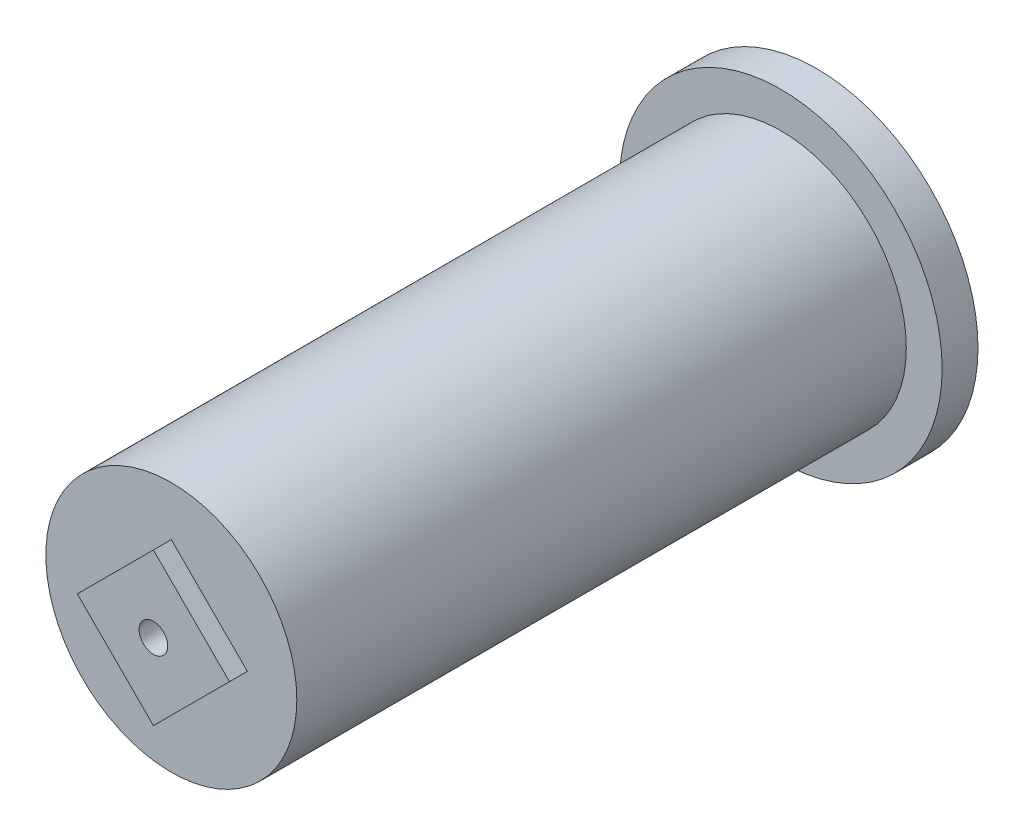
from build123d import *

# Parameters (mm, degrees)
SKETCH_1_R          = 22.5
EXTRUDE_1_DEPTH     = 5
SKETCH_2_R          = 17.5
EXTRUDE_2_DEPTH     = 85
EXTRUDE_3_DEPTH     = 2.5
SKETCH_4_R          = 2
CUT_EXTRUDE_1_DEPTH = 50


with BuildPart() as part:
    # Эскиз1 → Бобышка-Вытянуть1 (new body)
    with BuildSketch(Plane.XY):
        Circle(SKETCH_1_R)
    extrude(amount=EXTRUDE_1_DEPTH)

    # Эскиз2 → Бобышка-Вытянуть2 (add)
    with BuildSketch(Plane.XY.offset(5)):
        Circle(SKETCH_2_R)
    extrude(amount=EXTRUDE_2_DEPTH)

    # Эскиз3 → Бобышка-Вытянуть3 (add)
    with BuildSketch(Plane.XY.offset(90)):
        Polygon((10.606601718, 0), (0, 10.606601718), (-10.606601718, 0), (0, -10.606601718), align=None)
    extrude(amount=EXTRUDE_3_DEPTH)

    # Эскиз4 → Вырез-Вытянуть1 (cut)
    with BuildSketch(Plane.XY.offset(92.5)):
        Circle(SKETCH_4_R)
    extrude(amount=-CUT_EXTRUDE_1_DEPTH, mode=Mode.SUBTRACT)


solid = part.part
